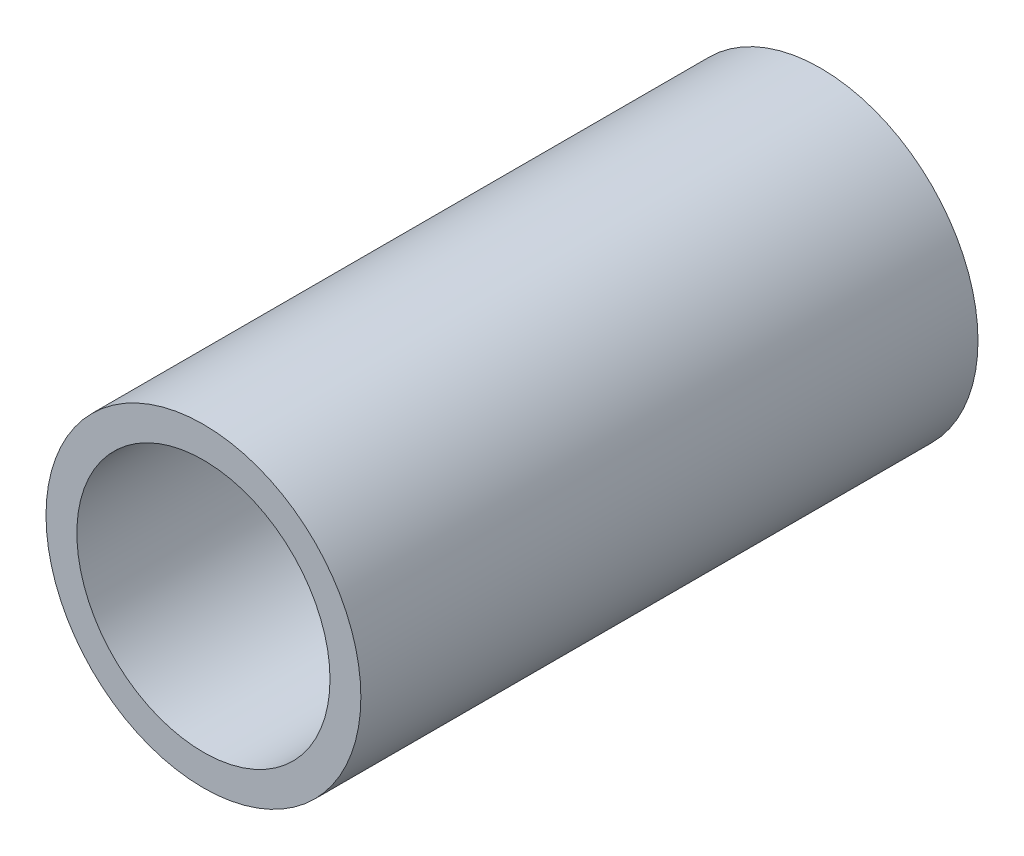
from build123d import *

# Parameters (mm, degrees)
BOSS_EXTRUDE1_DEPTH      = 12.446
BOSS_EXTRUDE1_DEPTH_BACK = 12.446
SKETCH3_R                = 6.35
SKETCH3_R_2              = 5.1054


with BuildPart() as part:
    # Sketch3 → Boss-Extrude1 (new, two sides: drawn at the far end of the back side and taken through both)
    with BuildSketch(Plane.XY.offset(-BOSS_EXTRUDE1_DEPTH_BACK)):
        Circle(SKETCH3_R)
        Circle(SKETCH3_R_2, mode=Mode.SUBTRACT)
    extrude(amount=BOSS_EXTRUDE1_DEPTH + BOSS_EXTRUDE1_DEPTH_BACK)


solid = part.part
